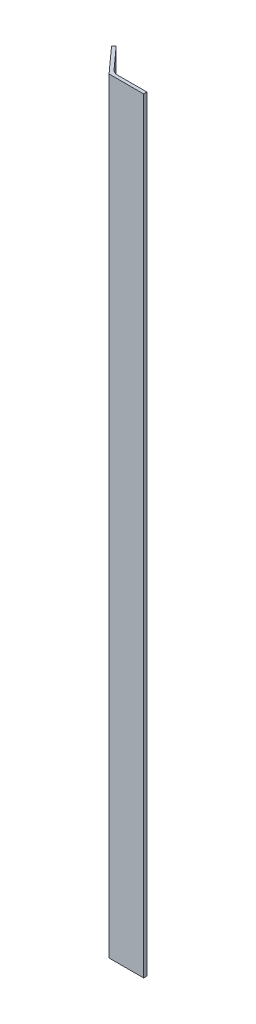
from build123d import *

# Parameters (mm, degrees)
EXTRUDE_START   = 40
EXTRUDE_1_DEPTH = 468.213673317


with BuildPart() as part:
    # Эскиз1 → Вытянуть1 (new body)
    with BuildSketch(Plane(origin=(0, 0, 0), x_dir=(1, 0, 0), z_dir=(0, 1, 0)).offset(EXTRUDE_START)):
        with BuildLine():
            Line((-18.082932157, 14.04269419), (-16.598207466, 15.382691425))
            Line((-16.598207466, 15.382691425), (-4.643574191, 2.136888581))
            ThreePointArc((-4.643574191, 2.136888581), (-2.962776318, 0.91796684), (-0.931762463, 0.48688167))
            Line((-0.931762463, 0.48688167), (17.122829042, 0.48688167))
            Line((17.122829042, 0.48688167), (17.122829042, -1.51311833))
            Line((17.122829042, -1.51311833), (-4.043463493, -1.51311833))
            Line((-4.043463493, -1.51311833), (-18.082932157, 14.04269419))
        make_face()
    extrude(amount=EXTRUDE_1_DEPTH)


solid = part.part
